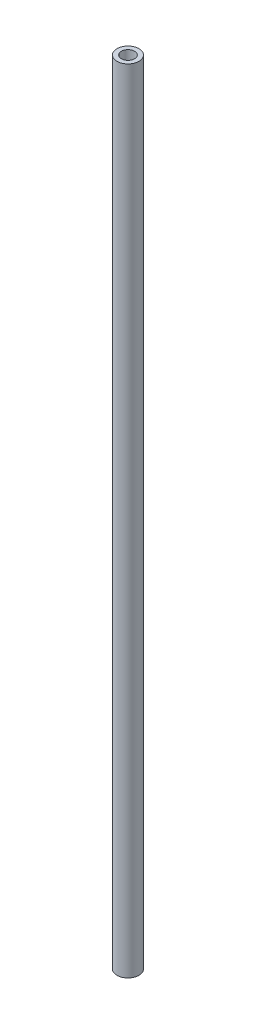
from build123d import *

# Parameters (mm, degrees)
SKETCH1_R           = 12.5
SKETCH1_R_2         = 7.5
BOSS_EXTRUDE1_DEPTH = 900


with BuildPart() as part:
    # Sketch1 → Boss-Extrude1 (new body)
    with BuildSketch(Plane(origin=(0, 0, 0), x_dir=(1, 0, 0), z_dir=(0, 1, 0))):
        with Locations(Location((0, 0, 0), (0, 0, 270))):
            Circle(SKETCH1_R)
        with Locations(Location((0, 0, 0), (0, 0, 270))):
            Circle(SKETCH1_R_2, mode=Mode.SUBTRACT)
    extrude(amount=BOSS_EXTRUDE1_DEPTH)


solid = part.part
